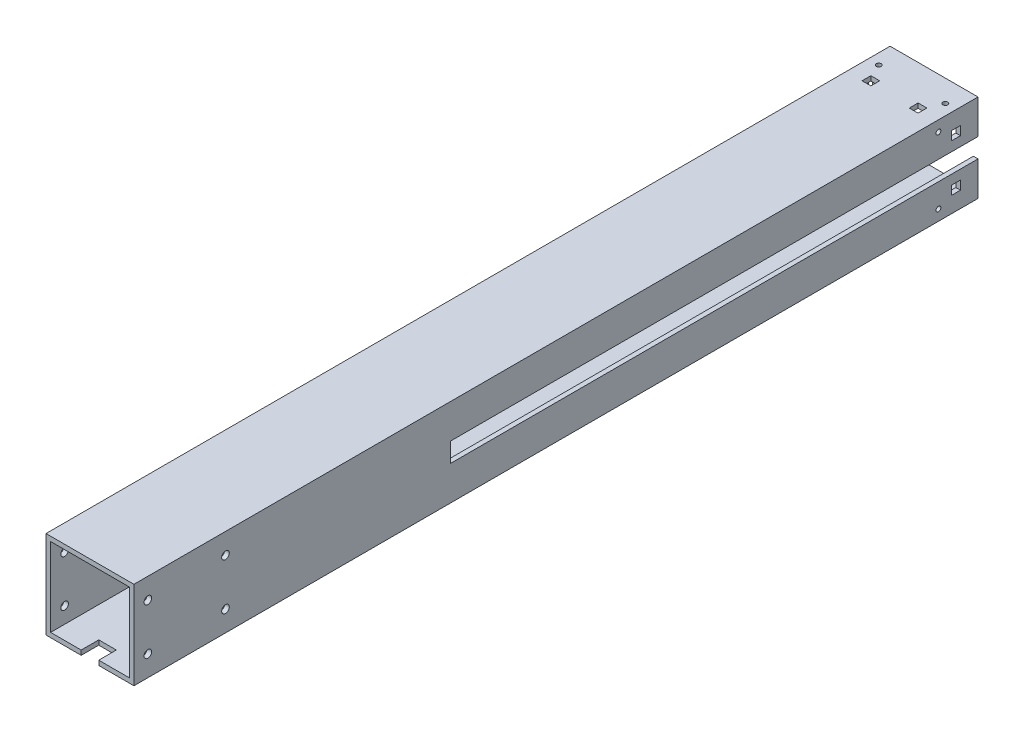
from build123d import *

# Parameters (mm, degrees)
BOSS_EXTRUDE1_DEPTH     = 609.6
CUT_EXTRUDE1_DEPTH      = 254
CUT_EXTRUDE1_DEPTH_BACK = 254
SKETCH2_R               = 1.75
SKETCH4_R               = 1.75
CUT_EXTRUDE2_DEPTH      = 254
SKETCH6_W               = 6.35
SKETCH6_H               = 6.35
CUT_EXTRUDE4_DEPTH      = 90.678
SKETCH7_W               = 6.35
SKETCH7_H               = 6.35
CUT_EXTRUDE5_DEPTH      = 122.174
SKETCH8_W               = 63.5
SKETCH8_H               = 228.6
BOSS_EXTRUDE2_DEPTH     = 3.33375
SKETCH9_R               = 2.75
CUT_EXTRUDE6_DEPTH      = 100.584
SKETCH11_W              = 12.7
SKETCH11_H              = 12.7
CUT_EXTRUDE8_DEPTH      = 31.496


with BuildPart() as part:
    # Sketch1 → Boss-Extrude1 (new body)
    with BuildSketch(Plane(origin=(0, 0, 0), x_dir=(0, 1, 0), z_dir=(0, 0, 1))):
        Polygon((28.41625, 28.41625), (28.41625, -28.41625), (6.985, -28.41625), (6.985, -31.75), (31.75, -31.75), (31.75, 31.75), (-31.75, 31.75), (-31.75, -31.75), (-6.985, -31.75), (-6.985, -28.41625), (-28.41625, -28.41625), (-28.41625, 28.41625), align=None)
    extrude(amount=BOSS_EXTRUDE1_DEPTH)

    # Sketch2 → Cut-Extrude1 (cut, two sides: drawn at the far end of the back side and taken through both)
    with BuildSketch(Plane(origin=(0, 0, 0), x_dir=(-1, 0, 0), z_dir=(0, 1, 0)).offset(-CUT_EXTRUDE1_DEPTH_BACK)):
        with Locations(Location((-24.05, 15.875, 0), (0, 0, 270))):
            Circle(SKETCH2_R)
        with Locations(Location((24.05, 15.875, 0), (0, 0, 270))):
            Circle(SKETCH2_R)
    extrude(amount=CUT_EXTRUDE1_DEPTH + CUT_EXTRUDE1_DEPTH_BACK, mode=Mode.SUBTRACT)

    # Sketch4 → Cut-Extrude2 (cut)
    with BuildSketch(Plane.YZ.offset(31.75)):
        with Locations((24.05, 28.575)):
            Circle(SKETCH4_R)
        with Locations((-24.05, 28.575)):
            Circle(SKETCH4_R)
    extrude(amount=-CUT_EXTRUDE2_DEPTH, mode=Mode.SUBTRACT)

    # Sketch6 → Cut-Extrude4 (cut)
    with BuildSketch(Plane.YZ.offset(31.75)):
        with Locations((17.05, 15.875)):
            Rectangle(SKETCH6_W, SKETCH6_H)
        with Locations((-17.05, 15.875)):
            Rectangle(SKETCH6_W, SKETCH6_H)
    extrude(amount=-CUT_EXTRUDE4_DEPTH, mode=Mode.SUBTRACT)

    # Sketch7 → Cut-Extrude5 (cut)
    with BuildSketch(Plane(origin=(0, 31.75, 0), x_dir=(-1, 0, 0), z_dir=(0, 1, 0))):
        with Locations((-17.05, 28.575)):
            Rectangle(SKETCH7_W, SKETCH7_H)
        with Locations((17.05, 28.575)):
            Rectangle(SKETCH7_W, SKETCH7_H)
    extrude(amount=-CUT_EXTRUDE5_DEPTH, mode=Mode.SUBTRACT)

    # Sketch8 → Boss-Extrude2 (add)
    with BuildSketch(Plane.YZ.offset(31.75)):
        with Locations((0, 495.3)):
            Rectangle(SKETCH8_W, SKETCH8_H)
    extrude(amount=-BOSS_EXTRUDE2_DEPTH)

    # Sketch9 → Cut-Extrude6 (cut)
    with BuildSketch(Plane.YZ.offset(31.75)):
        with Locations((-16.812006, 599.52001)):
            Circle(SKETCH9_R)
        with Locations((-16.812006, 543.47999)):
            Circle(SKETCH9_R)
        with Locations((16.812006, 543.47999)):
            Circle(SKETCH9_R)
        with Locations((16.812006, 599.52001)):
            Circle(SKETCH9_R)
    extrude(amount=-CUT_EXTRUDE6_DEPTH, mode=Mode.SUBTRACT)

    # Sketch11 → Cut-Extrude8 (cut)
    with BuildSketch(Plane(origin=(0, -28.41625, 0), x_dir=(-1, 0, 0), z_dir=(0, 1, 0))):
        with Locations((0, 603.25)):
            Rectangle(SKETCH11_W, SKETCH11_H)
    extrude(amount=-CUT_EXTRUDE8_DEPTH, mode=Mode.SUBTRACT)


solid = part.part
